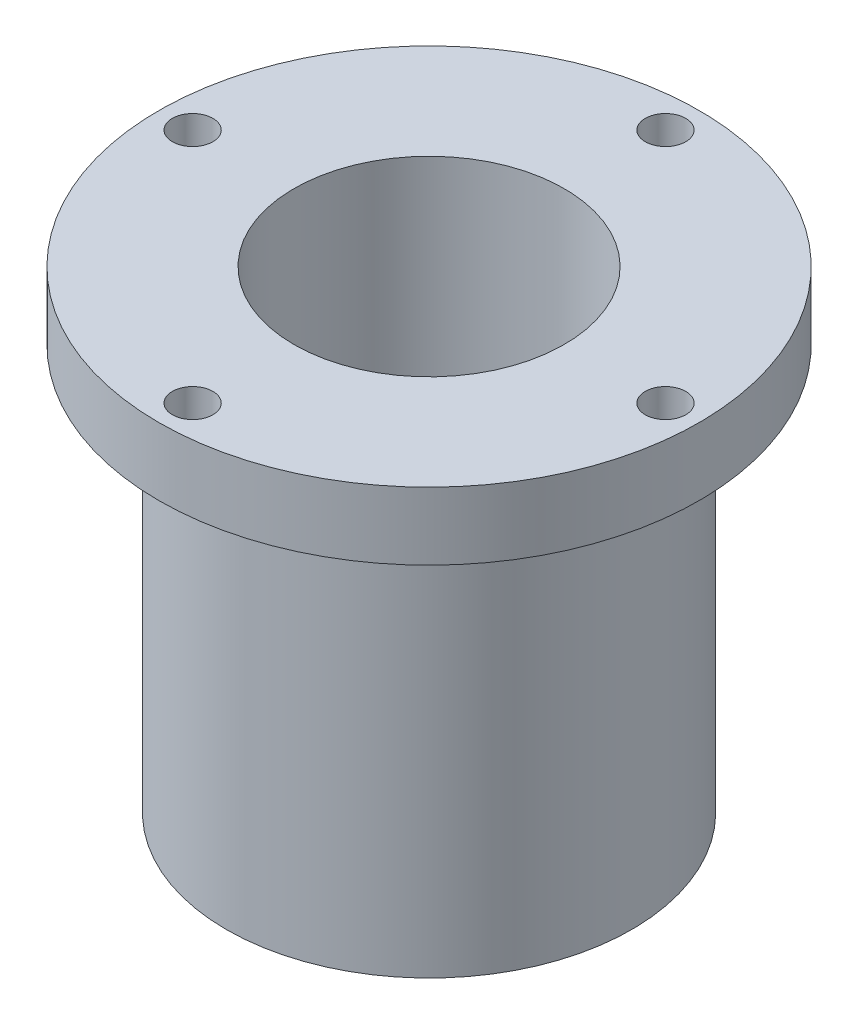
from build123d import *

# Parameters (mm, degrees)
SKETCH_1_R      = 15
SKETCH_1_R_2    = 10
EXTRUDE_1_DEPTH = 30
SKETCH_2_R      = 20
SKETCH_2_R_2    = 15
SKETCH_2_R_3    = 10
EXTRUDE_2_DEPTH = 5
F_3_0MM_1_D     = 3
F_3_0MM_1_DEPTH = 7.5
F_3_0MM_1_TIP   = 0.901290929


with BuildPart() as part:
    # 草图1 → 凸台-拉伸1 (new body)
    with BuildSketch(Plane(origin=(0, 0, 0), x_dir=(1, 0, 0), z_dir=(0, 1, 0))):
        with Locations(Location((0, 0, 0), (0, 0, 270))):
            Circle(SKETCH_1_R)
        with Locations(Location((0, 0, 0), (0, 0, 270))):
            Circle(SKETCH_1_R_2, mode=Mode.SUBTRACT)
    extrude(amount=EXTRUDE_1_DEPTH)

    # 草图2 → 凸台-拉伸2 (add)
    # profile 1 of 2: a face of its own
    with BuildSketch(Plane(origin=(0, 30, 0), x_dir=(1, 0, 0), z_dir=(0, 1, 0))):
        with Locations(Location((0, 0, 0), (0, 0, 270))):
            Circle(SKETCH_2_R)
        with Locations(Location((0, 0, 0), (0, 0, 270))):
            Circle(SKETCH_2_R_2, mode=Mode.SUBTRACT)
    # profile 2 of 2: a face of its own
    with BuildSketch(Plane(origin=(0, 30, 0), x_dir=(1, 0, 0), z_dir=(0, 1, 0))):
        with Locations(Location((0, 0, 0), (0, 0, 270))):
            Circle(SKETCH_2_R_2)
        with Locations(Location((0, 0, 0), (0, 0, 270))):
            Circle(SKETCH_2_R_3, mode=Mode.SUBTRACT)
    extrude(amount=EXTRUDE_2_DEPTH)

    # Ø3.0mm 暗销孔1
    with Locations(Plane(origin=(0, 35, 0), x_dir=(1, 0, 0), z_dir=(0, 1, 0))):
        with Locations((0, 17.5), (17.5, 0), (0, -17.5), (-17.5, 0)):
            Hole(F_3_0MM_1_D / 2, depth=F_3_0MM_1_DEPTH)
            with Locations((0, 0, -(F_3_0MM_1_DEPTH + F_3_0MM_1_TIP / 2))):  # 118° drill point
                Cone(0, F_3_0MM_1_D / 2, F_3_0MM_1_TIP, mode=Mode.SUBTRACT)


solid = part.part
